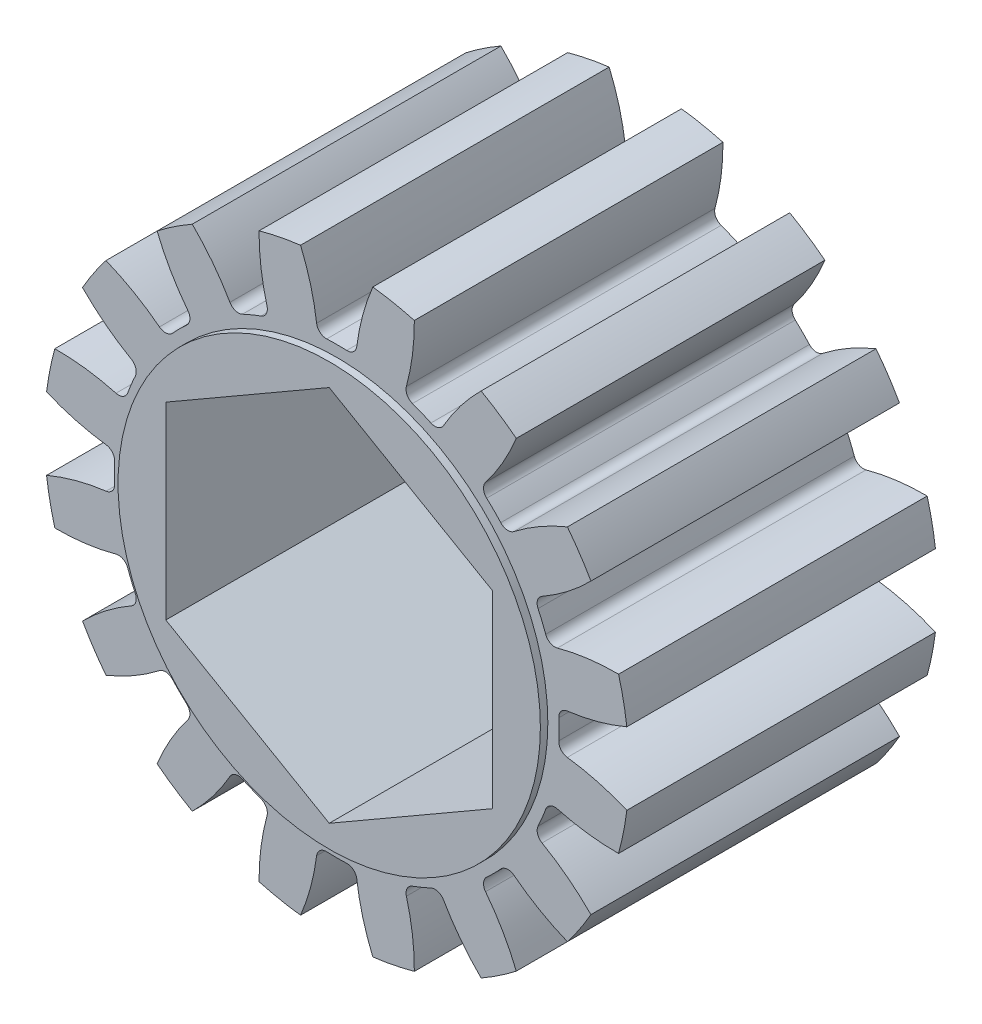
from build123d import *

# Parameters (mm, degrees)
CROQUIS1_R                 = 11.43
SALIENTE_EXTRUIR1_DEPTH    = 6.0325
CORTAR_EXTRUIR1_DEPTH      = 18.253430275
REDONDEO1_R                = 0.381028065
MATRIZC1_COUNT             = 16
REDONDEO1_OF_MATRIZC1_R    = 0.381028065
CROQUIS3_R                 = 8.255
SALIENTE_EXTRUIR2_DEPTH    = 6.3246
CORTAR_EXTRUIR2_DEPTH      = 18.242299714
CORTAR_EXTRUIR2_DEPTH_BACK = 18.242299714


with BuildPart() as part:
    # Croquis1 → Saliente-Extruir1 (new, symmetric)
    with BuildSketch(Plane.XY):
        with Locations(Location((0, 0, 0), (0, 0, 180))):
            Circle(CROQUIS1_R)
    extrude(amount=SALIENTE_EXTRUIR1_DEPTH, both=True)

    # Croquis2 → Cortar-Extruir1 (cut, symmetric)
    with BuildSketch(Plane.XY):
        with BuildLine():
            ThreePointArc((0.747134277, 8.658434763), (0, 8.69061), (-0.747134277, 8.658434763))
            ThreePointArc((-0.747134277, 8.658434763), (-0.974448264, 10.026589531), (-1.413058789, 11.342317438))
            ThreePointArc((-1.413058789, 11.342317438), (0, 11.43), (1.413058789, 11.342317438))
            ThreePointArc((1.413058789, 11.342317438), (0.974448264, 10.026589531), (0.747134277, 8.658434763))
        make_face()
    cortar_extruir1 = extrude(amount=CORTAR_EXTRUIR1_DEPTH, both=True, mode=Mode.SUBTRACT)

    # Redondeo1
    redondeo1_edges = [part.edges().sort_by_distance(p)[0] for p in [
        (0.747134277, 8.658434763, 0),
        (-0.747134277, 8.658434763, 0),
    ]]
    fillet(redondeo1_edges, radius=REDONDEO1_R)

    # MatrizC1: Cortar-Extruir1 ×16 about axis
    matrizc1_axis = Axis((0, 0, 0), (0, 0, 1))
    for i in range(1, MATRIZC1_COUNT):
        add(cortar_extruir1.rotate(matrizc1_axis, i * 360 / MATRIZC1_COUNT), mode=Mode.SUBTRACT)

    # Redondeo1 of MatrizC1
    redondeo1_of_matrizc1_edges = [part.edges().sort_by_distance(p)[0] for p in [
        (-2.623177467, 8.285266571, 0),
        (-4.003701601, 7.713434751, 0),
        (-5.594134221, 6.650741649, 0),
        (-6.650741649, 5.594134221, 0),
        (-7.713434751, 4.003701601, 0),
        (-8.285266571, 2.623177467, 0),
        (-8.658434763, 0.747134277, 0),
        (-8.658434763, -0.747134277, 0),
        (-8.285266571, -2.623177467, 0),
        (-7.713434751, -4.003701601, 0),
        (-6.650741649, -5.594134221, 0),
        (-5.594134221, -6.650741649, 0),
        (-4.003701601, -7.713434751, 0),
        (-2.623177467, -8.285266571, 0),
        (-0.747134277, -8.658434763, 0),
        (0.747134277, -8.658434763, 0),
        (2.623177467, -8.285266571, 0),
        (4.003701601, -7.713434751, 0),
        (5.594134221, -6.650741649, 0),
        (6.650741649, -5.594134221, 0),
        (7.713434751, -4.003701601, 0),
        (8.285266571, -2.623177467, 0),
        (8.658434763, -0.747134277, 0),
        (8.658434763, 0.747134277, 0),
        (8.285266571, 2.623177467, 0),
        (7.713434751, 4.003701601, 0),
        (6.650741649, 5.594134221, 0),
        (5.594134221, 6.650741649, 0),
        (4.003701601, 7.713434751, 0),
        (2.623177467, 8.285266571, 0),
    ]]
    fillet(redondeo1_of_matrizc1_edges, radius=REDONDEO1_OF_MATRIZC1_R)

    # Croquis3 → Saliente-Extruir2 (add, symmetric)
    with BuildSketch(Plane.XY):
        Circle(CROQUIS3_R)
    extrude(amount=SALIENTE_EXTRUIR2_DEPTH, both=True)

    # Croquis4 → Cortar-Extruir2 (cut, two sides: drawn at the far end of the back side and taken through both)
    with BuildSketch(Plane.XY.offset(-CORTAR_EXTRUIR2_DEPTH_BACK)):
        Polygon((0, 7.376342509), (-6.3881, 3.688171255), (-6.3881, -3.688171255), (0, -7.376342509), (6.3881, -3.688171255), (6.3881, 3.688171255), align=None)
    extrude(amount=CORTAR_EXTRUIR2_DEPTH + CORTAR_EXTRUIR2_DEPTH_BACK, mode=Mode.SUBTRACT)


solid = part.part
